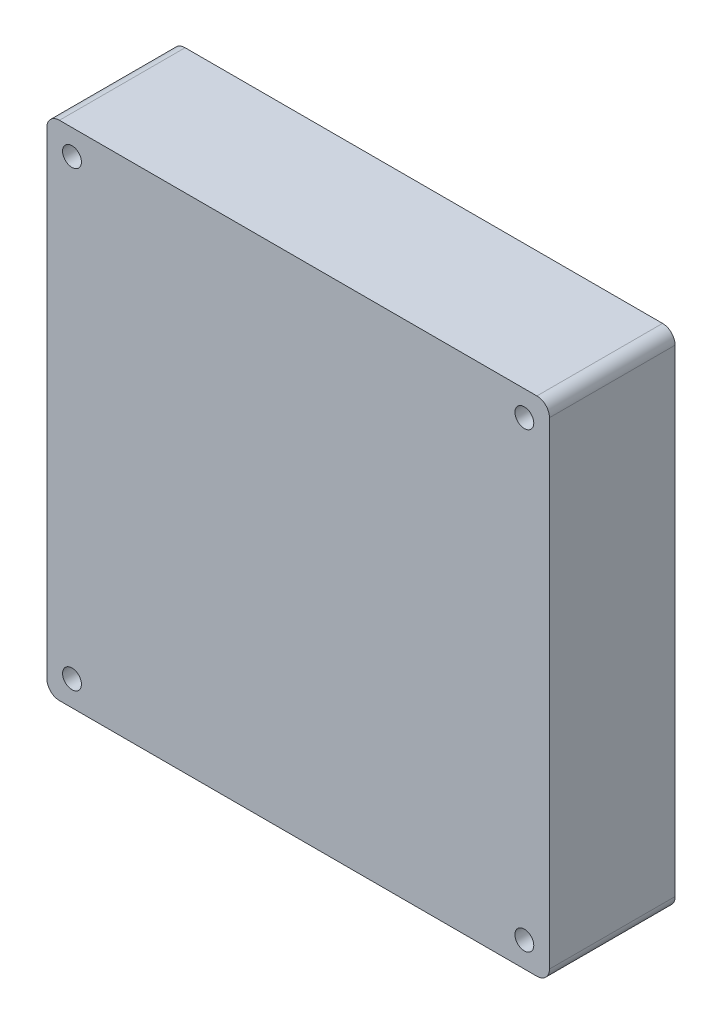
from build123d import *

# Parameters (mm, degrees)
SKETCH1_W           = 40
SKETCH1_H           = 40
BOSS_EXTRUDE1_DEPTH = 10
SKETCH2_R           = 0.75
CUT_EXTRUDE1_DEPTH  = 10
FILLET1_R           = 1


with BuildPart() as part:
    # Sketch1 → Boss-Extrude1 (new body)
    with BuildSketch(Plane.XY):
        with Locations((-20, 20)):
            Rectangle(SKETCH1_W, SKETCH1_H)
    extrude(amount=BOSS_EXTRUDE1_DEPTH)

    # Sketch2 → Cut-Extrude1 (cut)
    with BuildSketch(Plane.XY.offset(10)):
        with Locations((-38, 38)):
            Circle(SKETCH2_R)
        with Locations((-2, 38)):
            Circle(SKETCH2_R)
        with Locations((-2, 2)):
            Circle(SKETCH2_R)
        with Locations((-38, 2)):
            Circle(SKETCH2_R)
    extrude(amount=-CUT_EXTRUDE1_DEPTH, mode=Mode.SUBTRACT)

    # Fillet1
    fillet1_edges = [part.edges().sort_by_distance(p)[0] for p in [
        (0, 0, 5),
        (-40, 0, 5),
        (-40, 40, 5),
        (0, 40, 5),
    ]]
    fillet(fillet1_edges, radius=FILLET1_R)


solid = part.part
